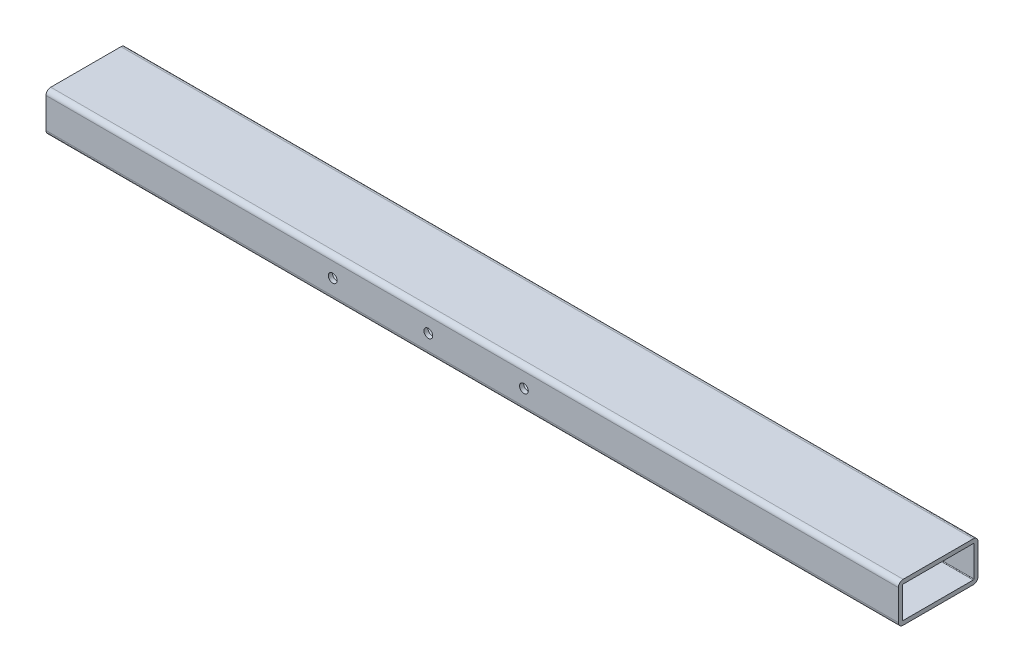
from build123d import *

# Parameters (mm, degrees)
TUBO_RETANGULAR_50_X_30_X_2_6_1_DEPTH = 535
ESBO_O2_R                             = 2.75
CORTE_EXTRUS_O1_DEPTH                 = 538.476743683


with BuildPart() as part:
    # Sketch1 → Tubo retangular 50 X 30 X 2.6(1) (new body)
    with BuildSketch(Plane.YZ):
        with BuildLine():
            Line((-9.5, -25), (9.5, -25))
            ThreePointArc((9.5, -25), (11.621320344, -24.121320344), (12.5, -22))
            Line((12.5, -22), (12.5, 22))
            ThreePointArc((12.5, 22), (11.621320344, 24.121320344), (9.5, 25))
            Line((9.5, 25), (-9.5, 25))
            ThreePointArc((-9.5, 25), (-11.621320344, 24.121320344), (-12.5, 22))
            Line((-12.5, 22), (-12.5, -22))
            ThreePointArc((-12.5, -22), (-11.621320344, -24.121320344), (-9.5, -25))
        make_face()
        with BuildLine():
            Line((-9.5, -22.4), (9.5, -22.4))
            ThreePointArc((9.5, -22.4), (9.782842712, -22.282842712), (9.9, -22))
            Line((9.9, -22), (9.9, 22))
            ThreePointArc((9.9, 22), (9.782842712, 22.282842712), (9.5, 22.4))
            Line((9.5, 22.4), (-9.5, 22.4))
            ThreePointArc((-9.5, 22.4), (-9.782842712, 22.282842712), (-9.9, 22))
            Line((-9.9, 22), (-9.9, -22))
            ThreePointArc((-9.9, -22), (-9.782842712, -22.282842712), (-9.5, -22.4))
        make_face(mode=Mode.SUBTRACT)
    extrude(amount=TUBO_RETANGULAR_50_X_30_X_2_6_1_DEPTH)

    # Esboço2 → Corte-extrusão1 (cut, through all)
    with BuildSketch(Plane(origin=(0, 0, -25), x_dir=(-1, 0, 0), z_dir=(0, 0, -1))):
        with Locations((-179.973841655, 0.2)):
            Circle(ESBO_O2_R)
        with Locations((-239.973841655, 0.2)):
            Circle(ESBO_O2_R)
        with Locations((-299.973841655, 0.2)):
            Circle(ESBO_O2_R)
    extrude(amount=-CORTE_EXTRUS_O1_DEPTH, mode=Mode.SUBTRACT)


solid = part.part
